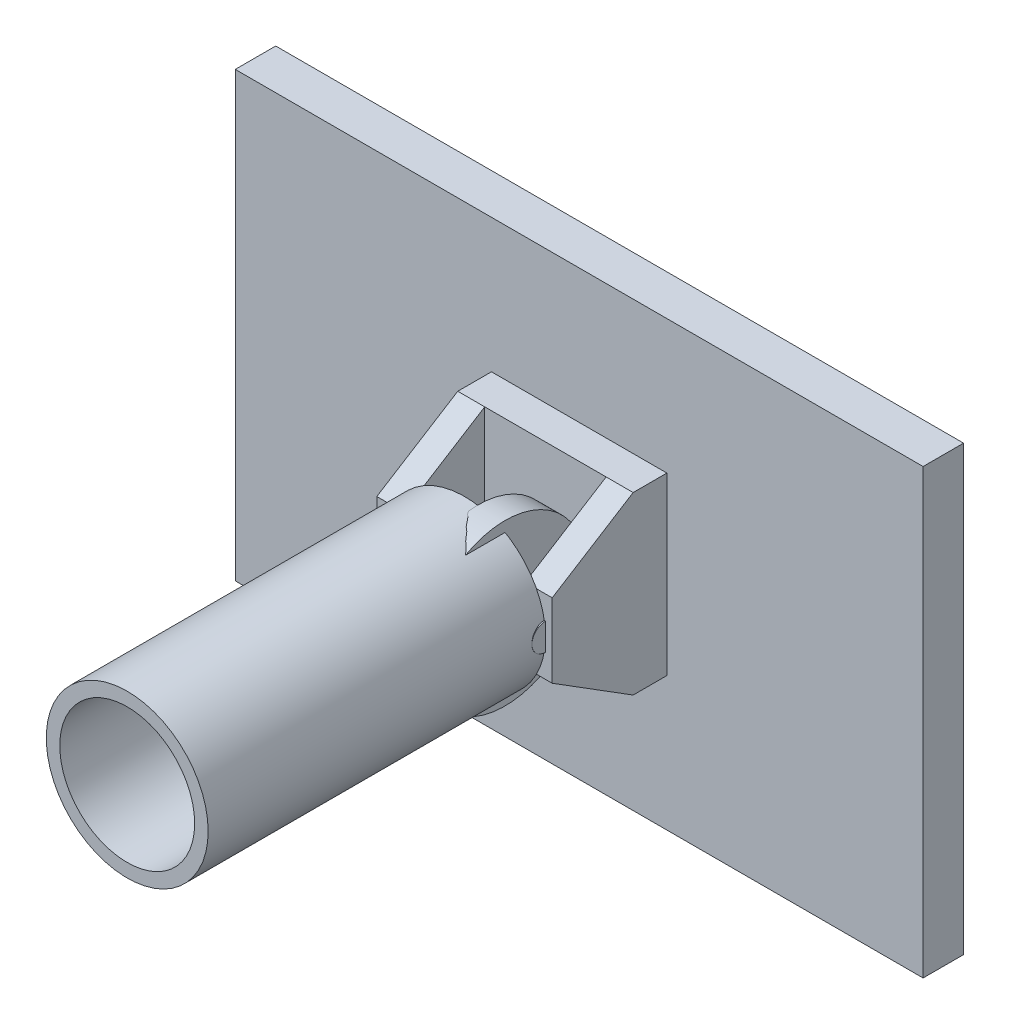
from build123d import *

# Parameters (mm, degrees)
SKETCH4_W            = 101.967936368
SKETCH4_H            = 65.666060288
BOSS_EXTRUDE4_DEPTH  = 6
SKETCH5_W            = 26
SKETCH5_H            = 26
BOSS_EXTRUDE5_DEPTH  = 5
BOSS_EXTRUDE6_DEPTH  = 4
SKETCH7_R            = 12
SKETCH7_R_2          = 10
EXTRUDE_THIN1_DEPTH  = 50
SKETCH8_R            = 1.75
BOSS_EXTRUDE7_DEPTH  = 5
BOSS_EXTRUDE8_START  = 2
SKETCH10_R           = 11.91
BOSS_EXTRUDE8_DEPTH  = 4
SKETCH11_R           = 2
BOSS_EXTRUDE9_DEPTH  = 12
SKETCH13_R           = 7.5
BOSS_EXTRUDE11_DEPTH = 10
BOSS_EXTRUDE12_START = -1
SKETCH14_R           = 4.125
BOSS_EXTRUDE12_DEPTH = 7
SKETCH15_R           = 3.348476615
BOSS_EXTRUDE13_DEPTH = 15
SKETCH16_W           = 13.310717663
SKETCH16_H           = 19.688769876
BOSS_EXTRUDE14_DEPTH = 19


with BuildPart() as part:
    # Sketch4 → Boss-Extrude4 (new body)
    with BuildSketch(Plane.XY):
        Rectangle(SKETCH4_W, SKETCH4_H)
    extrude(amount=BOSS_EXTRUDE4_DEPTH)

    # Sketch16 → Boss-Extrude14 (add)
    with BuildSketch(Plane(origin=(0, 0, 0), x_dir=(-1, 0, 0), z_dir=(0, 0, -1))):
        with Locations((-22.739142675, 0)):
            Rectangle(SKETCH16_W, SKETCH16_H)
    extrude(amount=BOSS_EXTRUDE14_DEPTH)


with BuildPart() as body_2:
    # Sketch5 → Boss-Extrude5 (new body)
    with BuildSketch(Plane.XY.offset(6)):
        Rectangle(SKETCH5_W, SKETCH5_H)
    extrude(amount=BOSS_EXTRUDE5_DEPTH)

    # Sketch6 → Boss-Extrude6 (add)
    with BuildSketch(Plane(origin=(13, 0, 0), x_dir=(0, 0, -1), z_dir=(1, 0, 0))):
        Polygon((-11, -13), (-23, -5.486969756), (-23, 5.486969756), (-11, 13), align=None)
    boss_extrude6 = extrude(amount=-BOSS_EXTRUDE6_DEPTH)

    # Mirror1: Boss-Extrude6 across plane
    add(boss_extrude6.mirror(Plane(origin=(0, 0, 0), x_dir=(0, 0, 1), z_dir=(1, 0, 0))))

    # Sketch13 → Boss-Extrude11 (add)
    with BuildSketch(Plane(origin=(0, 0, 6), x_dir=(-1, 0, 0), z_dir=(0, 0, -1))):
        with Locations(Location((0, 0, 0), (0, 0, 180))):
            Circle(SKETCH13_R)
    extrude(amount=BOSS_EXTRUDE11_DEPTH)

    # Sketch15 → Boss-Extrude13 (add)
    with BuildSketch(Plane(origin=(0, 0, -4), x_dir=(-1, 0, 0), z_dir=(0, 0, -1))):
        Circle(SKETCH15_R)
    extrude(amount=BOSS_EXTRUDE13_DEPTH)


with BuildPart() as body_3:
    # Sketch7 → Extrude-Thin1 (new body)
    with BuildSketch(Plane.XY.offset(23)):
        Circle(SKETCH7_R)
        Circle(SKETCH7_R_2, mode=Mode.SUBTRACT)
    extrude(amount=EXTRUDE_THIN1_DEPTH)


with BuildPart() as body_4:
    # Sketch8 → Boss-Extrude7 (new body)
    with BuildSketch(Plane.XY.offset(11)):
        Circle(SKETCH8_R)
    extrude(amount=BOSS_EXTRUDE7_DEPTH)


with BuildPart() as body_5:
    # Sketch10 → Boss-Extrude8 (new body)
    with BuildSketch(Plane(origin=(0, 0, 0), x_dir=(0, 0, -1), z_dir=(1, 0, 0)).offset(BOSS_EXTRUDE8_START)):
        with Locations((-23, 0)):
            Circle(SKETCH10_R)
    extrude(amount=BOSS_EXTRUDE8_DEPTH)


with BuildPart() as body_6:
    # Sketch11 → Boss-Extrude9 (new, symmetric)
    with BuildSketch(Plane(origin=(0, 0, 0), x_dir=(0, 0, -1), z_dir=(1, 0, 0))):
        with Locations((-23, 0)):
            Circle(SKETCH11_R)
    extrude(amount=BOSS_EXTRUDE9_DEPTH, both=True)


with BuildPart() as body_7:
    # Sketch14 → Boss-Extrude12 (new body)
    with BuildSketch(Plane(origin=(0, 0, 0), x_dir=(0, 0, -1), z_dir=(1, 0, 0)).offset(BOSS_EXTRUDE12_START)):
        with Locations((-23, 0)):
            Circle(SKETCH14_R)
    extrude(amount=-BOSS_EXTRUDE12_DEPTH)


solid = Compound([part.part, body_2.part, body_3.part, body_4.part, body_5.part, body_6.part, body_7.part])
